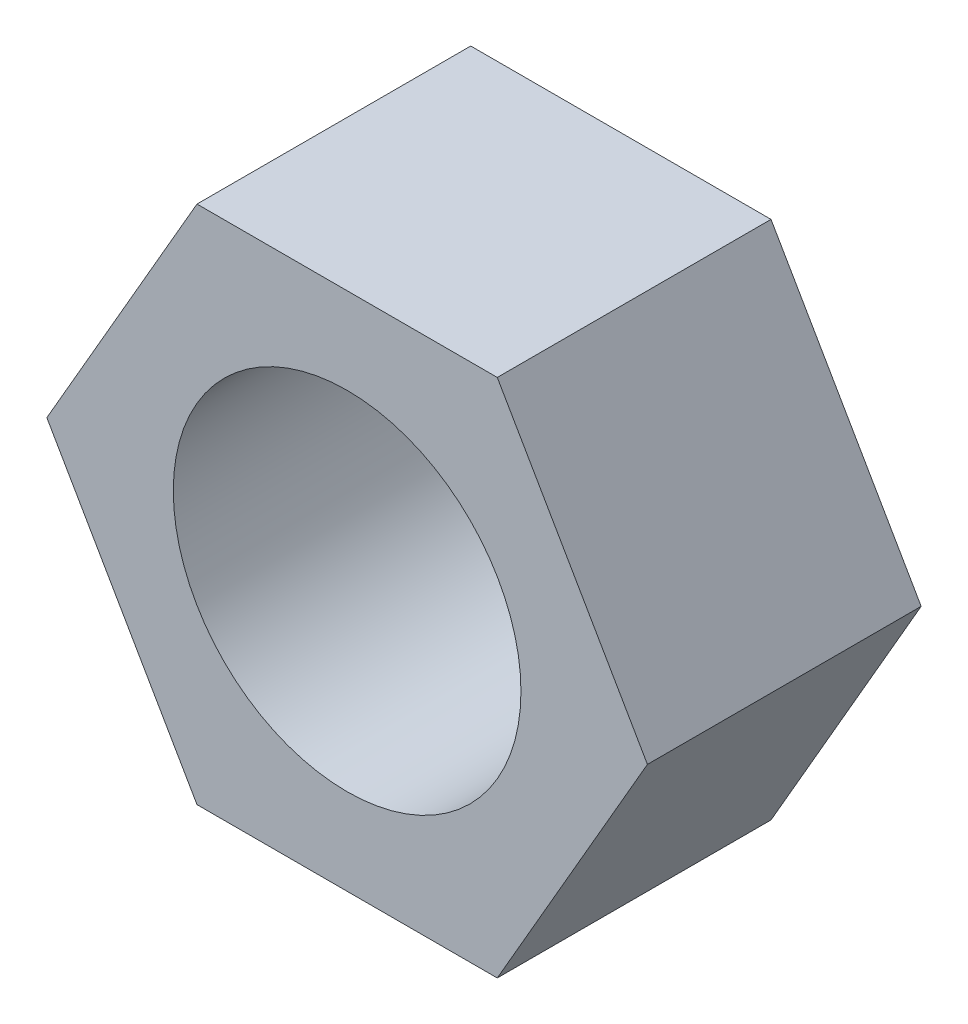
from build123d import *

# Parameters (mm, degrees)
CROQUIS1_R              = 6.35
SALIENTE_EXTRUIR1_DEPTH = 30
SALIENTE_EXTRUIR2_DEPTH = 10
CROQUIS4_R              = 6.35
CORTAR_EXTRUIR1_DEPTH   = 43.550949852


with BuildPart() as part:
    # Croquis1 → Saliente-Extruir1 (new body)
    with BuildSketch(Plane.XY):
        Circle(CROQUIS1_R)
    extrude(amount=SALIENTE_EXTRUIR1_DEPTH)

    # Croquis2 → Saliente-Extruir2 (add)
    with BuildSketch(Plane.XY.offset(30)):
        Polygon((10.969655115, 0), (5.484827557, 9.5), (-5.484827557, 9.5), (-10.969655115, 0), (-5.484827557, -9.5), (5.484827557, -9.5), align=None)
    extrude(amount=SALIENTE_EXTRUIR2_DEPTH)

    # Croquis4 → Cortar-Extruir1 (cut, through all)
    with BuildSketch(Plane(origin=(0, 0, 0), x_dir=(-1, 0, 0), z_dir=(0, 0, -1))):
        Circle(CROQUIS4_R)
    extrude(amount=-CORTAR_EXTRUIR1_DEPTH, mode=Mode.SUBTRACT)


solid = part.part
